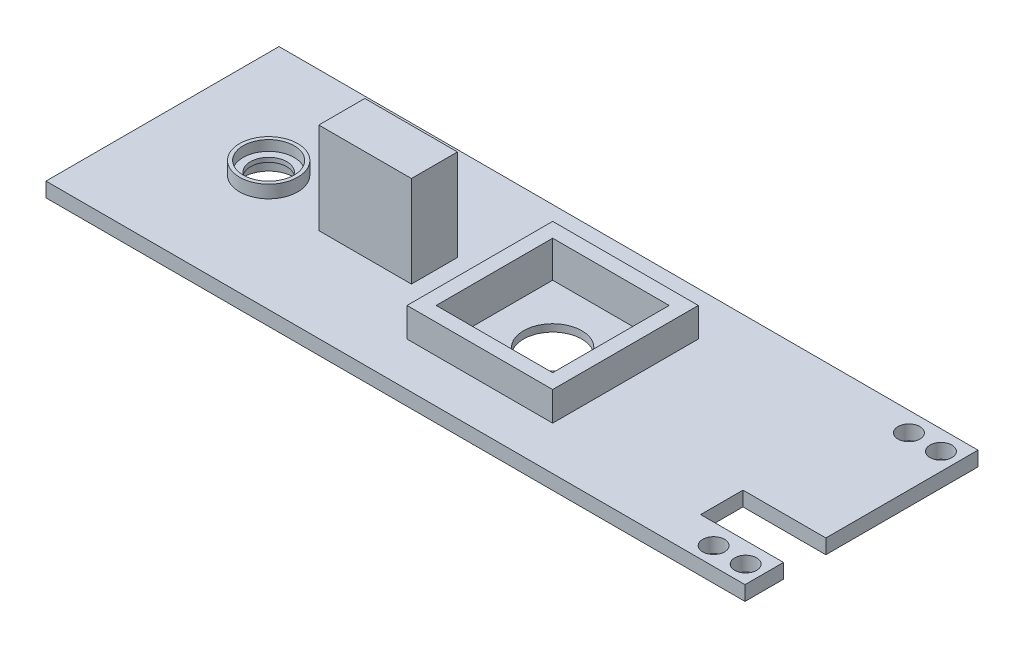
from build123d import *

# Parameters (mm, degrees)
SKETCH1_W           = 304.8
SKETCH1_H           = 101.6
BOSS_EXTRUDE1_DEPTH = 6.35
SKETCH2_R           = 12.7
BOSS_EXTRUDE3_DEPTH = 5.55625
SKETCH9_R           = 11.1125
CUT_EXTRUDE4_DEPTH  = 4.445
CUT_EXTRUDE5_START  = -5.55625
SKETCH10_R          = 11.1125
CUT_EXTRUDE5_DEPTH  = 5.55625
SKETCH11_R          = 7.9375
CUT_EXTRUDE6_DEPTH  = 310.094403462
SKETCH12_R          = 12.7
CUT_EXTRUDE7_DEPTH  = 310.0695755
SKETCH22_W          = 63.5
SKETCH22_H          = 63.5
BOSS_EXTRUDE7_DEPTH = 12.7
SKETCH25_W          = 50.8
SKETCH25_H          = 50.8
CUT_EXTRUDE11_DEPTH = 15.875
SKETCH18_W          = 40.386
SKETCH18_H          = 20.066
BOSS_EXTRUDE5_DEPTH = 39.878
SKETCH32_R          = 4.7625
CUT_EXTRUDE12_DEPTH = 6.35
SKETCH34_W          = 36.133088602
SKETCH34_H          = 18.470251096
CUT_EXTRUDE13_DEPTH = 312.566902742


with BuildPart() as part:
    # Sketch1 → Boss-Extrude1 (new body)
    with BuildSketch(Plane(origin=(0, 0, 0), x_dir=(1, 0, 0), z_dir=(0, 1, 0))):
        with Locations((-152.4, 0)):
            Rectangle(SKETCH1_W, SKETCH1_H)
    extrude(amount=BOSS_EXTRUDE1_DEPTH)

    # Sketch2 → Boss-Extrude3 (add)
    with BuildSketch(Plane(origin=(0, 6.35, 0), x_dir=(1, 0, 0), z_dir=(0, 1, 0))):
        with Locations(Location((-258.510557857, 0, 0), (0, 0, 90))):
            Circle(SKETCH2_R)
    extrude(amount=BOSS_EXTRUDE3_DEPTH)

    # Sketch9 → Cut-Extrude4 (cut)
    with BuildSketch(Plane(origin=(0, 11.90625, 0), x_dir=(1, 0, 0), z_dir=(0, 1, 0))):
        with Locations(Location((-258.510557857, 0, 0), (0, 0, 270))):
            Circle(SKETCH9_R)
    extrude(amount=-CUT_EXTRUDE4_DEPTH, mode=Mode.SUBTRACT)

    # Sketch10 → Cut-Extrude5 (cut)
    with BuildSketch(Plane(origin=(0, 0, 0), x_dir=(-1, 0, 0), z_dir=(0, -1, 0)).offset(CUT_EXTRUDE5_START)):
        with Locations(Location((258.510557857, 0, 0), (0, 0, 270))):
            Circle(SKETCH10_R)
    extrude(amount=CUT_EXTRUDE5_DEPTH, mode=Mode.SUBTRACT)

    # Sketch11 → Cut-Extrude6 (cut, through all)
    with BuildSketch(Plane(origin=(0, 7.46125, 0), x_dir=(1, 0, 0), z_dir=(0, 1, 0))):
        with Locations(Location((-258.510557857, 0, 0), (0, 0, 270))):
            Circle(SKETCH11_R)
    extrude(amount=-CUT_EXTRUDE6_DEPTH, mode=Mode.SUBTRACT)

    # Sketch12 → Cut-Extrude7 (cut, through all)
    with BuildSketch(Plane(origin=(0, 6.35, 0), x_dir=(1, 0, 0), z_dir=(0, 1, 0))):
        with Locations(Location((-134.666203771, 0, 0), (0, 0, 270))):
            Circle(SKETCH12_R)
    extrude(amount=-CUT_EXTRUDE7_DEPTH, mode=Mode.SUBTRACT)

    # Sketch22 → Boss-Extrude7 (add)
    with BuildSketch(Plane(origin=(0, 6.35, 0), x_dir=(1, 0, 0), z_dir=(0, 1, 0))):
        with Locations((-134.666203771, 0)):
            Rectangle(SKETCH22_W, SKETCH22_H)
    extrude(amount=BOSS_EXTRUDE7_DEPTH)

    # Sketch25 → Cut-Extrude11 (cut)
    with BuildSketch(Plane(origin=(0, 19.05, 0), x_dir=(1, 0, 0), z_dir=(0, 1, 0))):
        with Locations((-134.666203771, 0)):
            Rectangle(SKETCH25_W, SKETCH25_H)
    extrude(amount=-CUT_EXTRUDE11_DEPTH, mode=Mode.SUBTRACT)

    # Sketch18 → Boss-Extrude5 (add)
    with BuildSketch(Plane(origin=(0, 6.35, 0), x_dir=(1, 0, 0), z_dir=(0, 1, 0))):
        with Locations((-206.419013169, 0)):
            Rectangle(SKETCH18_W, SKETCH18_H)
    extrude(amount=BOSS_EXTRUDE5_DEPTH)

    # Sketch32 → Cut-Extrude12 (cut)
    with BuildSketch(Plane(origin=(0, 6.35, 0), x_dir=(1, 0, 0), z_dir=(0, 1, 0))):
        with Locations(Location((-7.62, -42.893773539, 0), (0, 0, 270))):
            Circle(SKETCH32_R)
        with Locations(Location((-21.59, -42.893773539, 0), (0, 0, 270))):
            Circle(SKETCH32_R)
        with Locations(Location((-7.62, 42.272941973, 0), (0, 0, 270))):
            Circle(SKETCH32_R)
        with Locations(Location((-21.59, 42.272941973, 0), (0, 0, 270))):
            Circle(SKETCH32_R)
    extrude(amount=-CUT_EXTRUDE12_DEPTH, mode=Mode.SUBTRACT)

    # Sketch34 → Cut-Extrude13 (cut, through all)
    with BuildSketch(Plane(origin=(0, 6.35, 0), x_dir=(1, 0, 0), z_dir=(0, 1, 0))):
        with Locations((-18.066544301, -24.7777)):
            Rectangle(SKETCH34_W, SKETCH34_H)
    extrude(amount=-CUT_EXTRUDE13_DEPTH, mode=Mode.SUBTRACT)


solid = part.part
